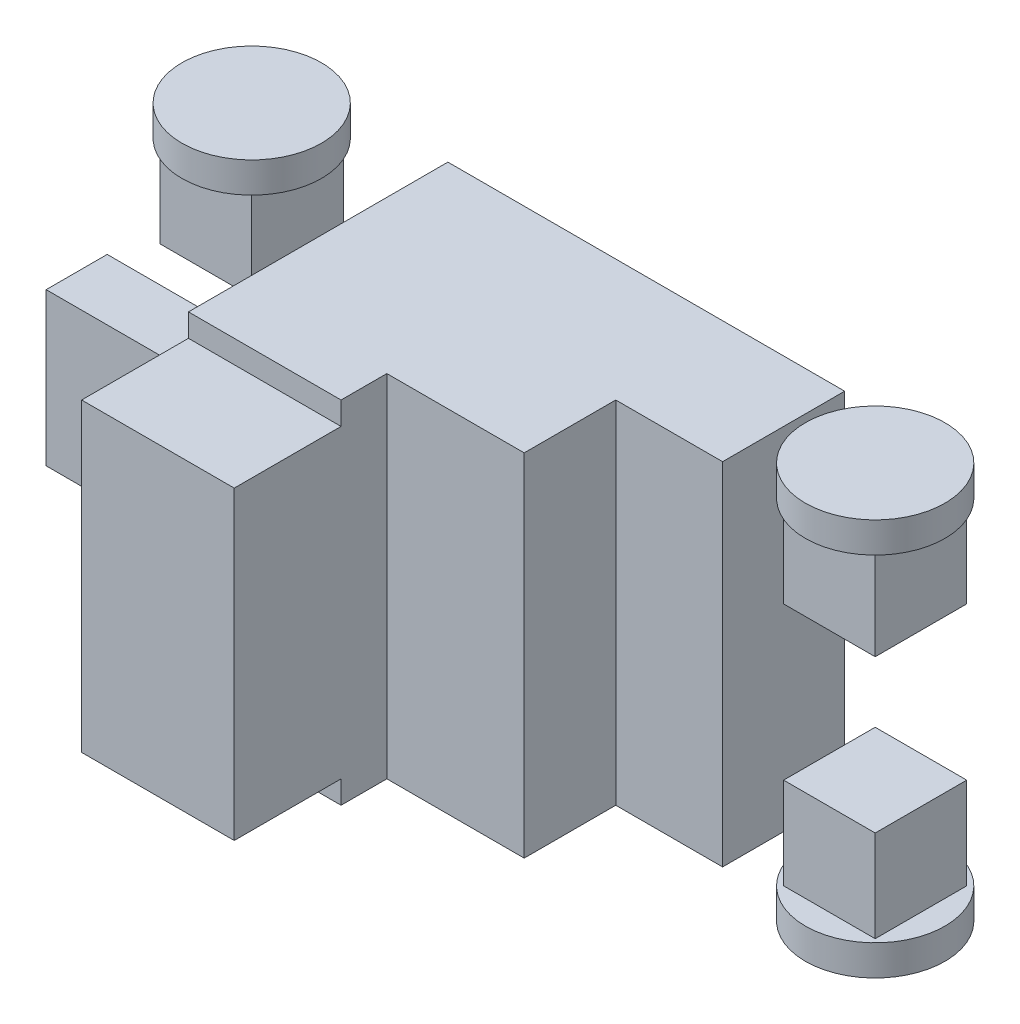
from build123d import *

# Parameters (mm, degrees)
BOSS_EXTRUDE1_START = 550
SKETCH1_R           = 228.6
BOSS_EXTRUDE1_DEPTH = 100
BOSS_EXTRUDE2_START = 237.5
SKETCH1_3_W         = 240
SKETCH1_3_H         = 130
BOSS_EXTRUDE2_DEPTH = 475
BOSS_EXTRUDE3_START = 250
SKETCH1_4_W         = 300
SKETCH1_4_H         = 300
BOSS_EXTRUDE3_DEPTH = 300
BOSS_EXTRUDE4_DEPTH = 575
SKETCH3_W           = 150
SKETCH3_H           = 350
CUT_EXTRUDE1_DEPTH  = 2150
BOSS_EXTRUDE5_START = 250
SKETCH1_6_W         = 300
SKETCH1_6_H         = 300
BOSS_EXTRUDE5_DEPTH = 300
BOSS_EXTRUDE6_START = 550
SKETCH1_7_R         = 228.6
BOSS_EXTRUDE6_DEPTH = 100
BOSS_EXTRUDE7_START = -250
SKETCH1_8_W         = 400
SKETCH1_8_H         = 200
BOSS_EXTRUDE7_DEPTH = 500


with BuildPart() as part:
    # Sketch1 → Boss-Extrude1 (new body)
    with BuildSketch(Plane(origin=(0, 0, 0), x_dir=(-1, 0, 0), z_dir=(0, 1, 0)).offset(BOSS_EXTRUDE1_START)):
        with Locations(Location((-978.6, 228.6, 0), (0, 0, 90))):
            Circle(SKETCH1_R)
    extrude(amount=BOSS_EXTRUDE1_DEPTH)

    # Sketch1<4> → Boss-Extrude3 (add)
    with BuildSketch(Plane(origin=(0, 0, 0), x_dir=(-1, 0, 0), z_dir=(0, 1, 0)).offset(BOSS_EXTRUDE3_START)):
        with Locations((-978.6, 228.6)):
            Rectangle(SKETCH1_4_W, SKETCH1_4_H)
    extrude(amount=BOSS_EXTRUDE3_DEPTH)


with BuildPart() as body_2:
    # Sketch1<3> → Boss-Extrude2 (new body)
    with BuildSketch(Plane(origin=(0, 0, 0), x_dir=(-1, 0, 0), z_dir=(0, 1, 0)).offset(BOSS_EXTRUDE2_START)):
        with Locations((848.531198444, 249.459130285)):
            Rectangle(SKETCH1_3_W, SKETCH1_3_H)
    extrude(amount=-BOSS_EXTRUDE2_DEPTH)


with BuildPart() as body_3:
    # Sketch1<5> → Boss-Extrude4 (new, symmetric)
    with BuildSketch(Plane(origin=(0, 0, 0), x_dir=(-1, 0, 0), z_dir=(0, 1, 0))):
        Polygon((650, 0), (650, 1200), (150, 1200), (150, 700), (-300, 700), (-300, 400), (-650, 400), (-650, 0), align=None)
    extrude(amount=BOSS_EXTRUDE4_DEPTH, both=True)

    # Sketch3 → Cut-Extrude1 (cut)
    with BuildSketch(Plane.YZ.offset(1500)):
        with Locations((-575, 1025)):
            Rectangle(SKETCH3_W, SKETCH3_H)
        with Locations((575, 1025)):
            Rectangle(SKETCH3_W, SKETCH3_H)
    extrude(amount=-CUT_EXTRUDE1_DEPTH, mode=Mode.SUBTRACT)


with BuildPart() as body_4:
    # Sketch1<6> → Boss-Extrude5 (new body)
    with BuildSketch(Plane(origin=(0, 0, 0), x_dir=(-1, 0, 0), z_dir=(0, 1, 0)).offset(BOSS_EXTRUDE5_START)):
        with Locations((1064.2, 228.6)):
            Rectangle(SKETCH1_6_W, SKETCH1_6_H)
    extrude(amount=BOSS_EXTRUDE5_DEPTH)

    # Sketch1<7> → Boss-Extrude6 (add)
    with BuildSketch(Plane(origin=(0, 0, 0), x_dir=(-1, 0, 0), z_dir=(0, 1, 0)).offset(BOSS_EXTRUDE6_START)):
        with Locations(Location((1064.2, 228.6, 0), (0, 0, 90))):
            Circle(SKETCH1_7_R)
    extrude(amount=BOSS_EXTRUDE6_DEPTH)


with BuildPart() as body_5:
    # Sketch1<8> → Boss-Extrude7 (new body)
    with BuildSketch(Plane(origin=(0, 0, 0), x_dir=(-1, 0, 0), z_dir=(0, 1, 0)).offset(BOSS_EXTRUDE7_START)):
        with Locations((1071.196951814, 595.030649521)):
            Rectangle(SKETCH1_8_W, SKETCH1_8_H)
    extrude(amount=BOSS_EXTRUDE7_DEPTH)


with BuildPart() as body_6:
    # Mirror1: mirrored copy
    add(part.part.mirror(Plane.ZX))


with BuildPart() as body_7:
    # Mirror1 2: mirrored copy
    add(body_4.part.mirror(Plane.ZX))


solid = Compound([part.part, body_2.part, body_3.part, body_4.part, body_5.part, body_6.part, body_7.part])
